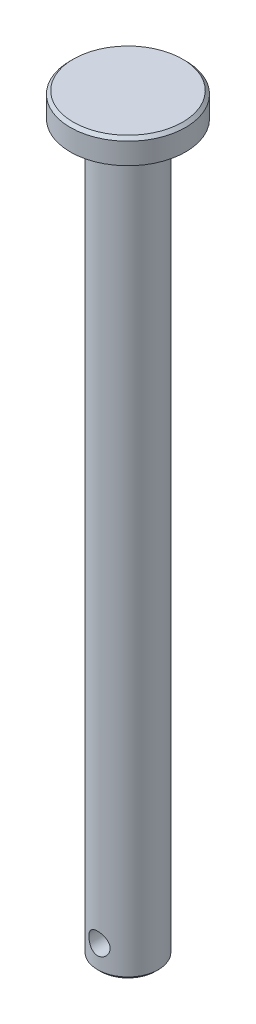
from build123d import *

# Parameters (mm, degrees)
CORTE_EXTRUS_O1_DEPTH      = 127.242712661
CORTE_EXTRUS_O1_DEPTH_BACK = 127.242712661
ESBO_O2_R                  = 3.5


with BuildPart() as part:
    # Esboço1 → Revolução1 (revolve)
    with BuildSketch(Plane(origin=(0, 0, 0), x_dir=(0, 0, -1), z_dir=(1, 0, 0)), mode=Mode.PRIVATE) as revolu_o1_sk:
        Polygon((0, 123.35), (18, 123.35), (19, 122.35), (19, 115.35), (10, 115.35), (10, -122.35), (9, -123.35), (0, -123.35), align=None)
    revolve(revolu_o1_sk.sketch.rotate(Axis((0, 123.35, 0), (0, -1, 0)), 180), axis=Axis((0, 123.35, 0), (0, -1, 0)))

    # Esboço2 → Corte-extrusão1 (cut, two sides: drawn at the far end of the back side and taken through both)
    with BuildSketch(Plane.XY.offset(-CORTE_EXTRUS_O1_DEPTH_BACK)):
        with Locations((0, -114.85)):
            Circle(ESBO_O2_R)
    extrude(amount=CORTE_EXTRUS_O1_DEPTH + CORTE_EXTRUS_O1_DEPTH_BACK, mode=Mode.SUBTRACT)


solid = part.part
